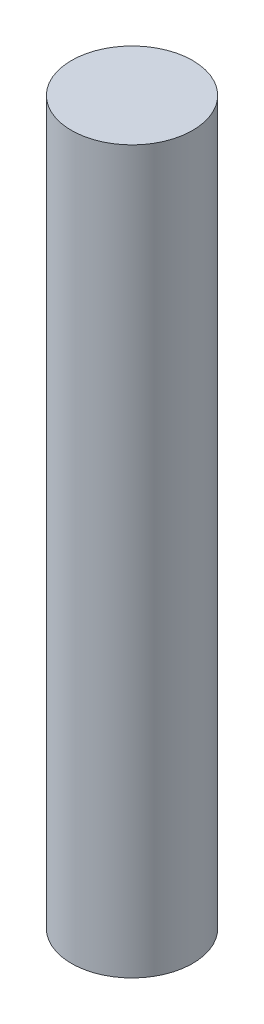
from build123d import *

# Parameters (mm, degrees)
SKETCH1_R           = 1.6002
BOSS_EXTRUDE1_DEPTH = 19.05


with BuildPart() as part:
    # Sketch1 → Boss-Extrude1 (new body)
    with BuildSketch(Plane(origin=(0, 0, 0), x_dir=(1, 0, 0), z_dir=(0, 1, 0))):
        with Locations(Location((0, 0, 0), (0, 0, 90))):
            Circle(SKETCH1_R)
    extrude(amount=BOSS_EXTRUDE1_DEPTH)


solid = part.part
